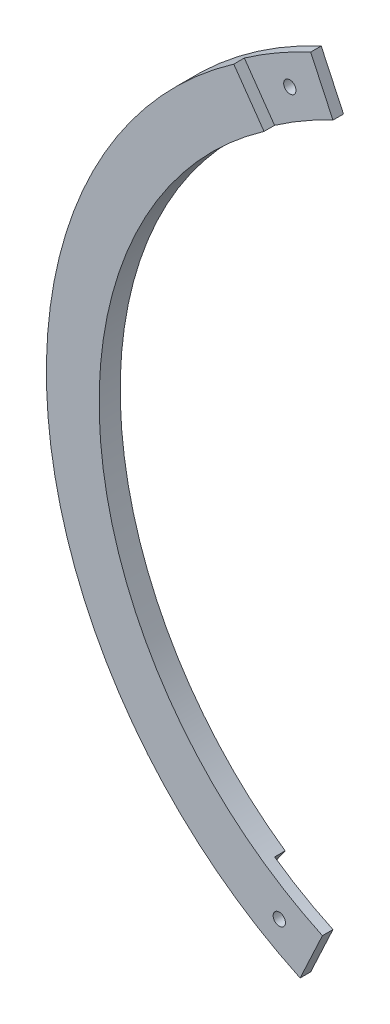
from build123d import *

# Parameters (mm, degrees)
BOSS_EXTRU_1_DEPTH      = 6
ESQUISSE3_R             = 1.75
ENL_V_MAT_EXTRU_1_DEPTH = 10
ENL_V_START             = -3
ENL_V_MAT_EXTRU_2_DEPTH = 3
ENL_V_MAT_EXTRU_3_DEPTH = 3


with BuildPart() as part:
    # Esquisse1 → Boss.-Extru.1 (new body)
    with BuildSketch(Plane.XY):
        with BuildLine():
            Line((-46.488008791, -99.693856574), (-52.827282718, -113.28847338))
            ThreePointArc((-52.827282718, -113.28847338), (-105.423930727, -67.162451043), (-125, 0))
            ThreePointArc((-125, 0), (-105.423930727, 67.162451043), (-52.827282718, 113.28847338))
            Line((-52.827282718, 113.28847338), (-46.488008791, 99.693856574))
            ThreePointArc((-46.488008791, 99.693856574), (-110, 0), (-46.488008791, -99.693856574))
        make_face()
    extrude(amount=BOSS_EXTRU_1_DEPTH)

    # Esquisse3 → Enlèv. mat.-Extru.1 (cut)
    with BuildSketch(Plane.XY.offset(6)):
        with Locations((-58.75, 101.757984945)):
            Circle(ESQUISSE3_R)
        with Locations((-58.75, -101.757984945)):
            Circle(ESQUISSE3_R)
    extrude(amount=-ENL_V_MAT_EXTRU_1_DEPTH, mode=Mode.SUBTRACT)

    # Esquisse4 → Enlèv. mat.-Extru.2 (cut)
    with BuildSketch(Plane.XY.offset(6).offset(ENL_V_START)):
        with BuildLine():
            Line((-71.697054544, 102.394005536), (-63.093407999, 90.106724872))
            ThreePointArc((-63.093407999, 90.106724872), (-55, 95.262794416), (-46.488008791, 99.693856574))
            Line((-46.488008791, 99.693856574), (-52.827282718, 113.28847338))
            ThreePointArc((-52.827282718, 113.28847338), (-62.5, 108.253175473), (-71.697054544, 102.394005536))
        make_face()
    extrude(amount=ENL_V_MAT_EXTRU_2_DEPTH, mode=Mode.SUBTRACT)

    # Esquisse6 → Enlèv. mat.-Extru.3 (cut)
    with BuildSketch(Plane(origin=(0, 0, 0), x_dir=(-1, 0, 0), z_dir=(0, 0, -1))):
        with BuildLine():
            Line((63.093407999, -90.106724872), (71.697054544, -102.394005536))
            ThreePointArc((71.697054544, -102.394005536), (62.5, -108.253175473), (52.827282718, -113.28847338))
            Line((52.827282718, -113.28847338), (46.488008791, -99.693856574))
            ThreePointArc((46.488008791, -99.693856574), (55, -95.262794416), (63.093407999, -90.106724872))
        make_face()
    extrude(amount=-ENL_V_MAT_EXTRU_3_DEPTH, mode=Mode.SUBTRACT)


solid = part.part
